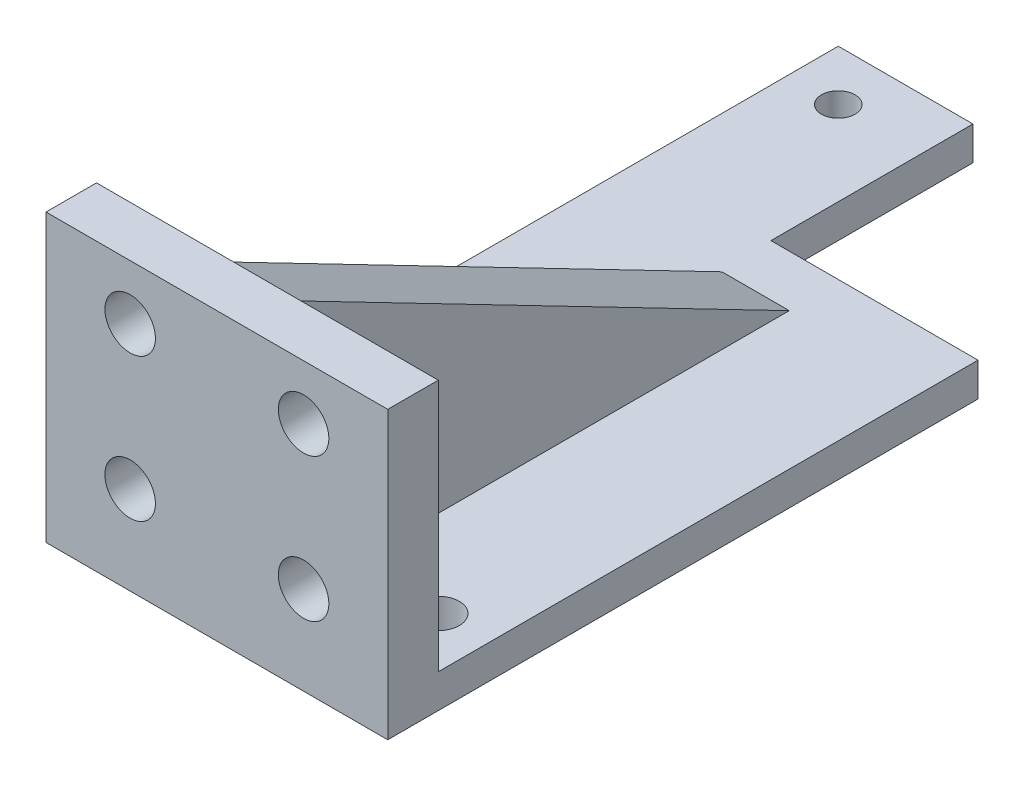
from build123d import *

# Parameters (mm, degrees)
EXTRUDE_1_DEPTH     = 2
SKETCH_2_W          = 20.3
SKETCH_2_H          = 3
EXTRUDE_2_DEPTH     = 15
SKETCH_3_R          = 1.5
CUT_EXTRUDE_1_DEPTH = 15
SKETCH_6_R          = 1.25
CUT_EXTRUDE_3_DEPTH = 10
EXTRUDE_3_DEPTH     = 2


with BuildPart() as part:
    # 草图1 → 凸台-拉伸1 (new body)
    with BuildSketch(Plane(origin=(0, 0, 0), x_dir=(1, 0, 0), z_dir=(0, 1, 0))):
        Polygon((8, 47.06), (0, 47.06), (0, 44.06), (0, 0), (20.3, 0), (20.3, 35.06), (8, 35.06), align=None)
        with BuildLine():
            ThreePointArc((4, 44.06), (3, 43.06), (2, 44.06))
            ThreePointArc((2, 44.06), (3, 45.06), (4, 44.06))
        make_face(mode=Mode.SUBTRACT)
    extrude(amount=EXTRUDE_1_DEPTH)

    # 草图2 → 凸台-拉伸2 (add)
    with BuildSketch(Plane(origin=(0, 2, 0), x_dir=(1, 0, 0), z_dir=(0, 1, 0))):
        with Locations((10.15, 1.5)):
            Rectangle(SKETCH_2_W, SKETCH_2_H)
    extrude(amount=EXTRUDE_2_DEPTH)

    # 草图3 → 切除-拉伸1 (cut)
    with BuildSketch(Plane(origin=(0, 0, -3), x_dir=(-1, 0, 0), z_dir=(0, 0, -1))):
        with Locations((-15.3, 13.75)):
            Circle(SKETCH_3_R)
        with Locations((-15.3, 5.25)):
            Circle(SKETCH_3_R)
        with Locations((-5, 13.75)):
            Circle(SKETCH_3_R)
        with Locations((-5, 5.25)):
            Circle(SKETCH_3_R)
    extrude(amount=-CUT_EXTRUDE_1_DEPTH, mode=Mode.SUBTRACT)

    # 草图6 → 切除-拉伸3 (cut)
    with BuildSketch(Plane.XZ):
        with Locations(Location((17.3, -6, 0), (0, 0, 270))):
            Circle(SKETCH_6_R)
    extrude(amount=-CUT_EXTRUDE_3_DEPTH, mode=Mode.SUBTRACT)

    # 草图7 → 凸台-拉伸3 (add, symmetric)
    with BuildSketch(Plane.ZY.offset(-10.15)):
        Polygon((-3, 17), (-3, 2), (-32.000508887, 2), align=None)
    extrude(amount=EXTRUDE_3_DEPTH, both=True)


solid = part.part
